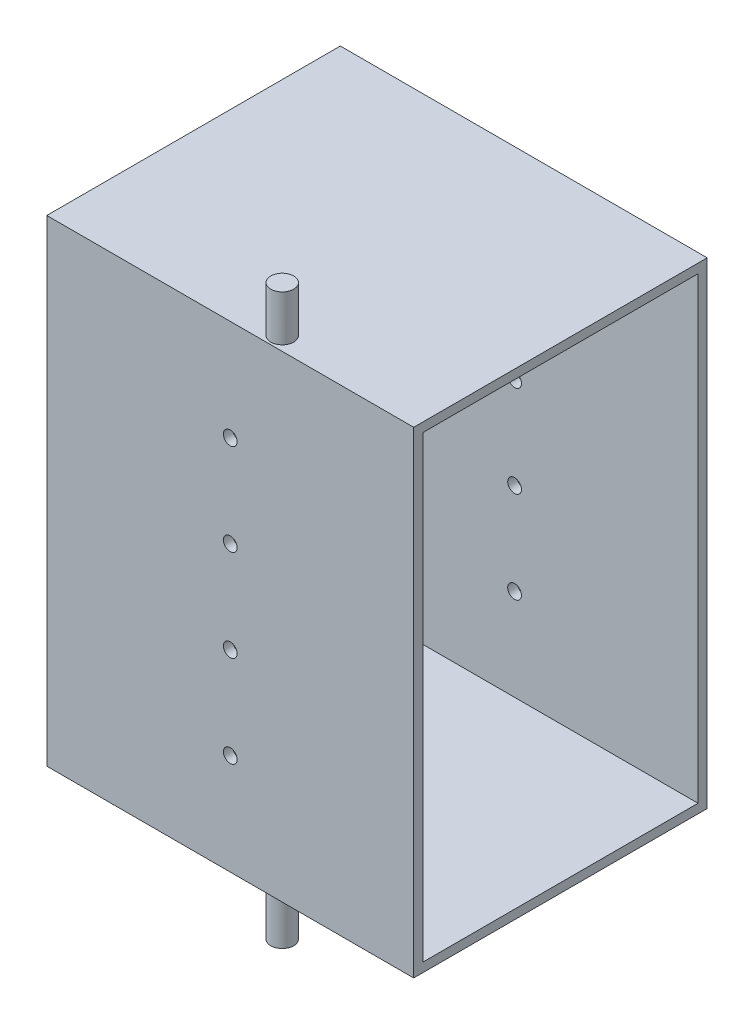
from build123d import *

# Parameters (mm, degrees)
DUCT_THROAT_START           = 18
SKETCH1_W                   = 60
SKETCH1_H                   = 100
DUCT_THROAT_DEPTH           = 80
CARBON_WALL_SHELL_T         = 2
PIVOT_HOLE_PAIRS_DEPTH      = 218.926593145
PIVOT_HOLE_PAIRS_DEPTH_BACK = 218.926593145
SKETCH2_R                   = 1.5
SKETCH3_R                   = 2.5
SMA_ANCHOR_PEG_DEPTH        = 10
BIAS_ANCHOR_PEG_START       = 10
SKETCH4_R                   = 2.5
BIAS_ANCHOR_PEG_DEPTH       = 10


with BuildPart() as part:
    # Sketch1 → Duct_Throat (new body)
    with BuildSketch(Plane(origin=(0, 0, 0), x_dir=(0, 0, -1), z_dir=(1, 0, 0)).offset(DUCT_THROAT_START)):
        with Locations((0, 140)):
            Rectangle(SKETCH1_W, SKETCH1_H)
    extrude(amount=DUCT_THROAT_DEPTH)

    # Carbon_Wall_Shell
    carbon_wall_shell_openings = [part.faces().sort_by_distance(p)[0] for p in [
        (18, 140, 0),
        (98, 140, 0),
    ]]
    offset(amount=CARBON_WALL_SHELL_T, openings=carbon_wall_shell_openings, kind=Kind.INTERSECTION)

    # Sketch2 → Pivot_Hole_Pairs (cut, two sides: drawn at the far end of the back side and taken through both)
    with BuildSketch(Plane.XY.offset(-PIVOT_HOLE_PAIRS_DEPTH_BACK)):
        with Locations((58, 110)):
            Circle(SKETCH2_R)
        with Locations((58, 130)):
            Circle(SKETCH2_R)
        with Locations((58, 150)):
            Circle(SKETCH2_R)
        with Locations((58, 170)):
            Circle(SKETCH2_R)
    extrude(amount=PIVOT_HOLE_PAIRS_DEPTH + PIVOT_HOLE_PAIRS_DEPTH_BACK, mode=Mode.SUBTRACT)

    # Sketch3 → SMA_Anchor_Peg (add)
    with BuildSketch(Plane(origin=(0, 192, 0), x_dir=(1, 0, 0), z_dir=(0, 1, 0))):
        with Locations(Location((66.342275148, -29, 0), (0, 0, 90))):
            Circle(SKETCH3_R)
    extrude(amount=SMA_ANCHOR_PEG_DEPTH)

    # Sketch4 → Bias_Anchor_Peg (add)
    with BuildSketch(Plane.XZ.offset(-88).offset(BIAS_ANCHOR_PEG_START)):
        with Locations(Location((66.342275148, 29, 0), (0, 0, 270))):
            Circle(SKETCH4_R)
    extrude(amount=-BIAS_ANCHOR_PEG_DEPTH)


solid = part.part
